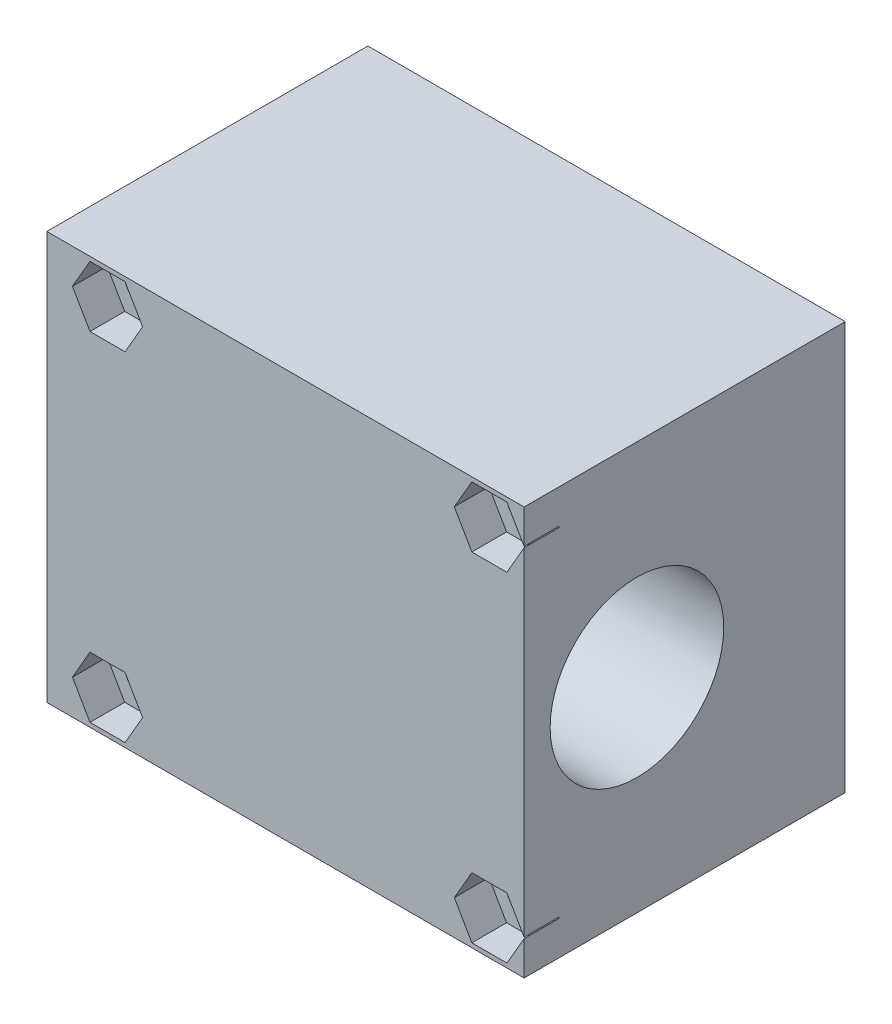
from build123d import *

# Parameters (mm, degrees)
ESQUISSE1_W             = 55
ESQUISSE1_H             = 47
BOSS_EXTRU_1_DEPTH      = 37
ESQUISSE2_R             = 2
ENL_V_MAT_EXTRU_1_DEPTH = 82.258845672
ESQUISSE3_W             = 50
ESQUISSE3_H             = 45
ENL_V_MAT_EXTRU_2_DEPTH = 1
ESQUISSE4_W             = 48
ESQUISSE4_H             = 43
ENL_V_MAT_EXTRU_3_DEPTH = 10
ESQUISSE5_R             = 10
ENL_V_MAT_EXTRU_4_DEPTH = 40
ESQUISSE6_W             = 20
ESQUISSE6_H             = 20
ENL_V_MAT_EXTRU_5_DEPTH = 10
ESQUISSE7_W             = 5
ESQUISSE7_H             = 20
ENL_V_MAT_EXTRU_6_DEPTH = 4
ESQUISSE10_R            = 2.5
ENL_V_MAT_EXTRU_7_DEPTH = 72.95832127
ENL_V_MAT_EXTRU_8_DEPTH = 4


with BuildPart() as part:
    # Esquisse1 → Boss.-Extru.1 (new body)
    with BuildSketch(Plane.XY):
        with Locations((27.5, 23.5)):
            Rectangle(ESQUISSE1_W, ESQUISSE1_H)
    extrude(amount=BOSS_EXTRU_1_DEPTH)

    # Esquisse2 → Enlèv. mat.-Extru.1 (cut, through all)
    with BuildSketch(Plane(origin=(0, 0, 0), x_dir=(-1, 0, 0), z_dir=(0, 0, -1))):
        with Locations((-51, 43)):
            Circle(ESQUISSE2_R)
        with Locations((-7, 43)):
            Circle(ESQUISSE2_R)
        with Locations((-7, 4)):
            Circle(ESQUISSE2_R)
        with Locations((-51, 4)):
            Circle(ESQUISSE2_R)
    extrude(amount=-ENL_V_MAT_EXTRU_1_DEPTH, mode=Mode.SUBTRACT)

    # Esquisse3 → Enlèv. mat.-Extru.2 (cut)
    with BuildSketch(Plane(origin=(0, 0, 0), x_dir=(-1, 0, 0), z_dir=(0, 0, -1))):
        with Locations((-29, 23.5)):
            Rectangle(ESQUISSE3_W, ESQUISSE3_H)
    extrude(amount=-ENL_V_MAT_EXTRU_2_DEPTH, mode=Mode.SUBTRACT)

    # Esquisse4 → Enlèv. mat.-Extru.3 (cut)
    with BuildSketch(Plane(origin=(0, 0, 1), x_dir=(-1, 0, 0), z_dir=(0, 0, -1))):
        with Locations((-29, 23.5)):
            Rectangle(ESQUISSE4_W, ESQUISSE4_H)
    extrude(amount=-ENL_V_MAT_EXTRU_3_DEPTH, mode=Mode.SUBTRACT)

    # Esquisse5 → Enlèv. mat.-Extru.4 (cut)
    with BuildSketch(Plane(origin=(55, 0, 0), x_dir=(0, 0, -1), z_dir=(1, 0, 0))):
        with Locations((-24, 23.5)):
            Circle(ESQUISSE5_R)
    extrude(amount=-ENL_V_MAT_EXTRU_4_DEPTH, mode=Mode.SUBTRACT)

    # Esquisse6 → Enlèv. mat.-Extru.5 (cut)
    with BuildSketch(Plane.ZY):
        with Locations((24, 23.5)):
            Rectangle(ESQUISSE6_W, ESQUISSE6_H)
    extrude(amount=-ENL_V_MAT_EXTRU_5_DEPTH, mode=Mode.SUBTRACT)

    # Esquisse7 → Enlèv. mat.-Extru.6 (cut)
    with BuildSketch(Plane(origin=(0, 0, 11), x_dir=(-1, 0, 0), z_dir=(0, 0, -1))):
        with Locations((-7.5, 23.5)):
            Rectangle(ESQUISSE7_W, ESQUISSE7_H)
    extrude(amount=-ENL_V_MAT_EXTRU_6_DEPTH, mode=Mode.SUBTRACT)

    # Esquisse10 → Enlèv. mat.-Extru.7 (cut, through all)
    with BuildSketch(Plane(origin=(15, 0, 0), x_dir=(0, 0, -1), z_dir=(1, 0, 0))):
        with Locations((-24, 23.5)):
            Circle(ESQUISSE10_R)
        with Locations((-19.5, 28)):
            Circle(ESQUISSE10_R)
        with Locations((-19.5, 19)):
            Circle(ESQUISSE10_R)
        with Locations((-28.5, 19)):
            Circle(ESQUISSE10_R)
        with Locations((-28.5, 28)):
            Circle(ESQUISSE10_R)
    extrude(amount=-ENL_V_MAT_EXTRU_7_DEPTH, mode=Mode.SUBTRACT)

    # Esquisse11 → Enlèv. mat.-Extru.8 (cut)
    with BuildSketch(Plane.XY.offset(37)):
        Polygon((11.041451884, 43), (9.020725942, 46.5), (4.979274058, 46.5), (2.958548116, 43), (4.979274058, 39.5), (9.020725942, 39.5), align=None)
        Polygon((46.958548116, 43), (48.979274058, 39.5), (53.020725942, 39.5), (55.041451884, 43), (53.020725942, 46.5), (48.979274058, 46.5), align=None)
        Polygon((46.958548116, 4), (48.979274058, 0.5), (53.020725942, 0.5), (55.041451884, 4), (53.020725942, 7.5), (48.979274058, 7.5), align=None)
        Polygon((11.041451884, 4), (9.020725942, 7.5), (4.979274058, 7.5), (2.958548116, 4), (4.979274058, 0.5), (9.020725942, 0.5), align=None)
    extrude(amount=-ENL_V_MAT_EXTRU_8_DEPTH, mode=Mode.SUBTRACT)


solid = part.part
